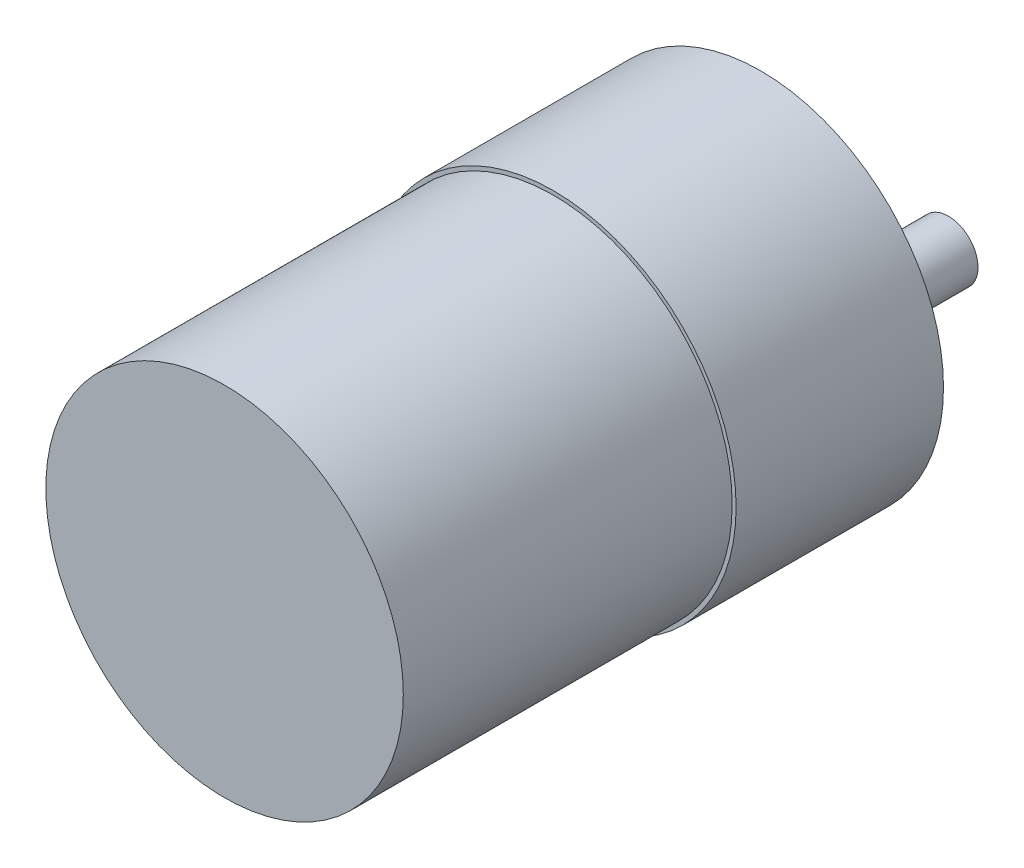
from build123d import *

# Parameters (mm, degrees)
SKETCH1_R           = 18.5
INNER_DEPTH         = 21
SKETCH2_R           = 18.1
OUTER_DEPTH         = 33.3
SKETCH3_R           = 6
BOSS_EXTRUDE3_DEPTH = 5
SKETCH7_R           = 3
BOSS_EXTRUDE6_DEPTH = 14


with BuildPart() as part:
    # Sketch1 → Inner (new body)
    with BuildSketch(Plane.XY):
        with Locations(Location((0, 0, 0), (0, 0, 180))):
            Circle(SKETCH1_R)
    extrude(amount=INNER_DEPTH)

    # Sketch2 → Outer (add)
    with BuildSketch(Plane.XY.offset(21)):
        Circle(SKETCH2_R)
    extrude(amount=OUTER_DEPTH)

    # Sketch3 → Boss-Extrude3 (add)
    with BuildSketch(Plane(origin=(0, 0, 0), x_dir=(-1, 0, 0), z_dir=(0, 0, -1))):
        with Locations(Location((0, -6.742, 0), (0, 0, 180))):
            Circle(SKETCH3_R)
    extrude(amount=BOSS_EXTRUDE3_DEPTH)

    # Sketch7 → Boss-Extrude6 (add)
    with BuildSketch(Plane(origin=(0, 0, -5), x_dir=(-1, 0, 0), z_dir=(0, 0, -1))):
        with Locations((0, -6.742)):
            Circle(SKETCH7_R)
    extrude(amount=BOSS_EXTRUDE6_DEPTH)


solid = part.part
